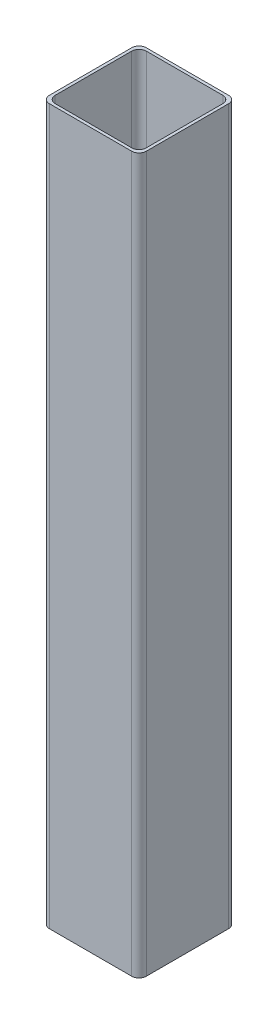
from build123d import *

# Parameters (mm, degrees)
ESBO_O1_W                = 40
ESBO_O1_H                = 40
ESBO_O1_W_2              = 37.6
ESBO_O1_H_2              = 37.6
RESSALTO_EXTRUS_O1_DEPTH = 147.5
FILETE1_R                = 3


with BuildPart() as part:
    # Esboço1 → Ressalto-extrusão1 (new, symmetric)
    with BuildSketch(Plane(origin=(0, 0, 0), x_dir=(1, 0, 0), z_dir=(0, 1, 0))):
        Rectangle(ESBO_O1_W, ESBO_O1_H)
        Rectangle(ESBO_O1_W_2, ESBO_O1_H_2, mode=Mode.SUBTRACT)
    extrude(amount=RESSALTO_EXTRUS_O1_DEPTH, both=True)

    # Filete1
    filete1_edges = [part.edges().sort_by_distance(p)[0] for p in [
        (-18.8, 0, 18.8),
        (18.8, 0, 18.8),
        (18.8, 0, -18.8),
        (-18.8, 0, -18.8),
        (-20, 0, -20),
        (20, 0, -20),
        (20, 0, 20),
        (-20, 0, 20),
    ]]
    fillet(filete1_edges, radius=FILETE1_R)


solid = part.part
